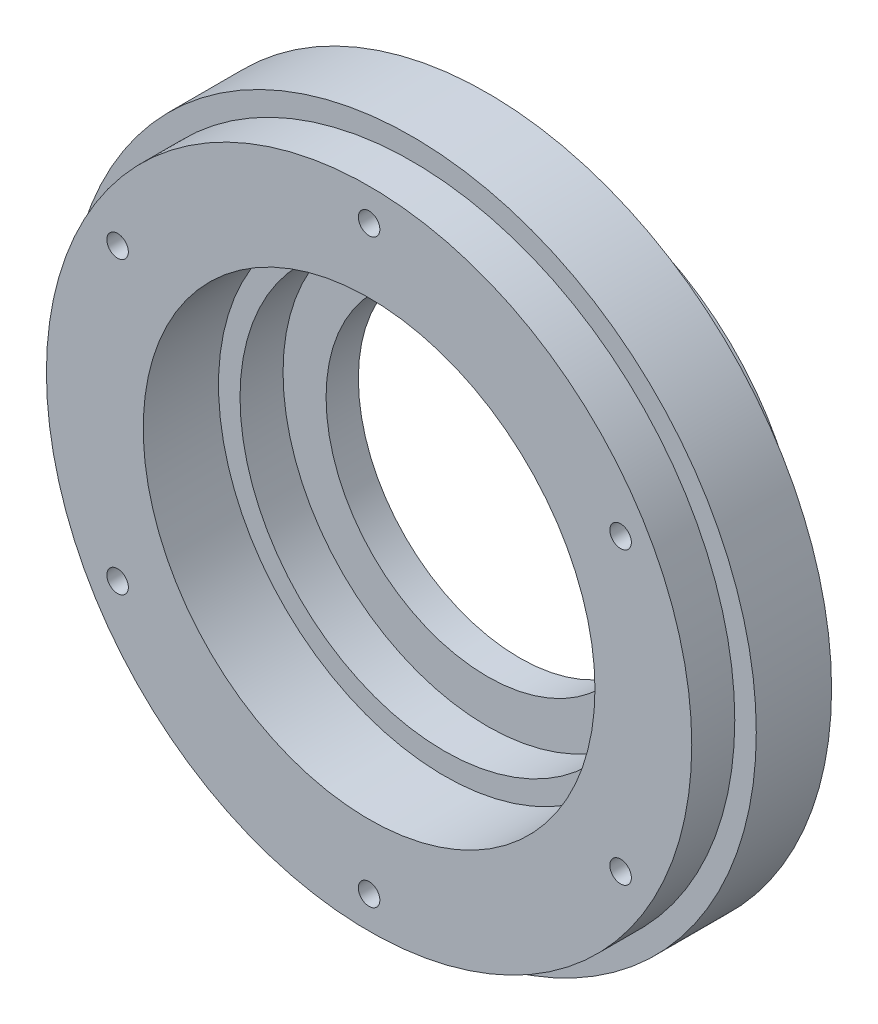
from build123d import *

# Parameters (mm, degrees)
SKETCH_1_R          = 32
SKETCH_1_R_2        = 19
EXTRUDE_1_DEPTH     = 4
SKETCH_2_R          = 32
SKETCH_2_R_2        = 21
EXTRUDE_2_DEPTH     = 7
SKETCH_3_R          = 1
CUT_EXTRUDE_1_DEPTH = 47.572524089
CUT_EXTRUDE_2_DEPTH = 6
SKETCH_5_R          = 22.45
SKETCH_5_R_2        = 15
EXTRUDE_3_DEPTH     = 7
SKETCH_6_R          = 21.05
CUT_EXTRUDE_3_DEPTH = 4
CUT_EXTRUDE_START   = -4
SKETCH_7_R          = 32
SKETCH_7_R_2        = 30
CUT_EXTRUDE_4_DEPTH = 4


with BuildPart() as part:
    # 草图1 → 凸台-拉伸1 (new body)
    with BuildSketch(Plane.XY):
        Circle(SKETCH_1_R)
        Circle(SKETCH_1_R_2, mode=Mode.SUBTRACT)
    extrude(amount=EXTRUDE_1_DEPTH)

    # 草图2 → 凸台-拉伸2 (add)
    with BuildSketch(Plane.XY.offset(4)):
        Circle(SKETCH_2_R)
        Circle(SKETCH_2_R_2, mode=Mode.SUBTRACT)
    extrude(amount=EXTRUDE_2_DEPTH)

    # 草图3 → 切除-拉伸1 (cut, through all)
    with BuildSketch(Plane.XY.offset(11)):
        with Locations((0, 27)):
            Circle(SKETCH_3_R)
        with Locations((23.382685902, 13.5)):
            Circle(SKETCH_3_R)
        with Locations((23.382685902, -13.5)):
            Circle(SKETCH_3_R)
        with Locations((0, -27)):
            Circle(SKETCH_3_R)
        with Locations((-23.382685902, -13.5)):
            Circle(SKETCH_3_R)
        with Locations((-23.382685902, 13.5)):
            Circle(SKETCH_3_R)
    extrude(amount=-CUT_EXTRUDE_1_DEPTH, mode=Mode.SUBTRACT)

    # 草图4 → 切除-拉伸2 (cut)
    with BuildSketch(Plane(origin=(0, 0, 0), x_dir=(-1, 0, 0), z_dir=(0, 0, -1))):
        Polygon((21.073284825, 13.5), (22.227985364, 11.5), (24.537386441, 11.5), (25.692086979, 13.5), (24.537386441, 15.5), (22.227985364, 15.5), align=None)
        Polygon((-1.154700538, 25), (1.154700538, 25), (2.309401077, 27), (1.154700538, 29), (-1.154700538, 29), (-2.309401077, 27), align=None)
        Polygon((22.227985364, -11.5), (21.073284825, -13.5), (22.227985364, -15.5), (24.537386441, -15.5), (25.692086979, -13.5), (24.537386441, -11.5), align=None)
        Polygon((1.154700538, -25), (-1.154700538, -25), (-2.309401077, -27), (-1.154700538, -29), (1.154700538, -29), (2.309401077, -27), align=None)
        Polygon((-21.073284825, -13.5), (-22.227985364, -11.5), (-24.537386441, -11.5), (-25.692086979, -13.5), (-24.537386441, -15.5), (-22.227985364, -15.5), align=None)
        Polygon((-22.227985364, 11.5), (-21.073284825, 13.5), (-22.227985364, 15.5), (-24.537386441, 15.5), (-25.692086979, 13.5), (-24.537386441, 11.5), align=None)
    extrude(amount=-CUT_EXTRUDE_2_DEPTH, mode=Mode.SUBTRACT)

    # 草图5 → 凸台-拉伸3 (add)
    with BuildSketch(Plane(origin=(0, 0, 0), x_dir=(-1, 0, 0), z_dir=(0, 0, -1))):
        with Locations(Location((0, 0, 0), (0, 0, 180))):
            Circle(SKETCH_5_R)
        Circle(SKETCH_5_R_2, mode=Mode.SUBTRACT)
    extrude(amount=EXTRUDE_3_DEPTH)

    # 草图6 → 切除-拉伸3 (cut)
    with BuildSketch(Plane(origin=(0, 0, -7), x_dir=(-1, 0, 0), z_dir=(0, 0, -1))):
        Circle(SKETCH_6_R)
    extrude(amount=-CUT_EXTRUDE_3_DEPTH, mode=Mode.SUBTRACT)

    # 草图7 → 切除-拉伸4 (cut)
    with BuildSketch(Plane.XY.offset(11).offset(CUT_EXTRUDE_START)):
        Circle(SKETCH_7_R)
        Circle(SKETCH_7_R_2, mode=Mode.SUBTRACT)
    extrude(amount=CUT_EXTRUDE_4_DEPTH, mode=Mode.SUBTRACT)


solid = part.part
